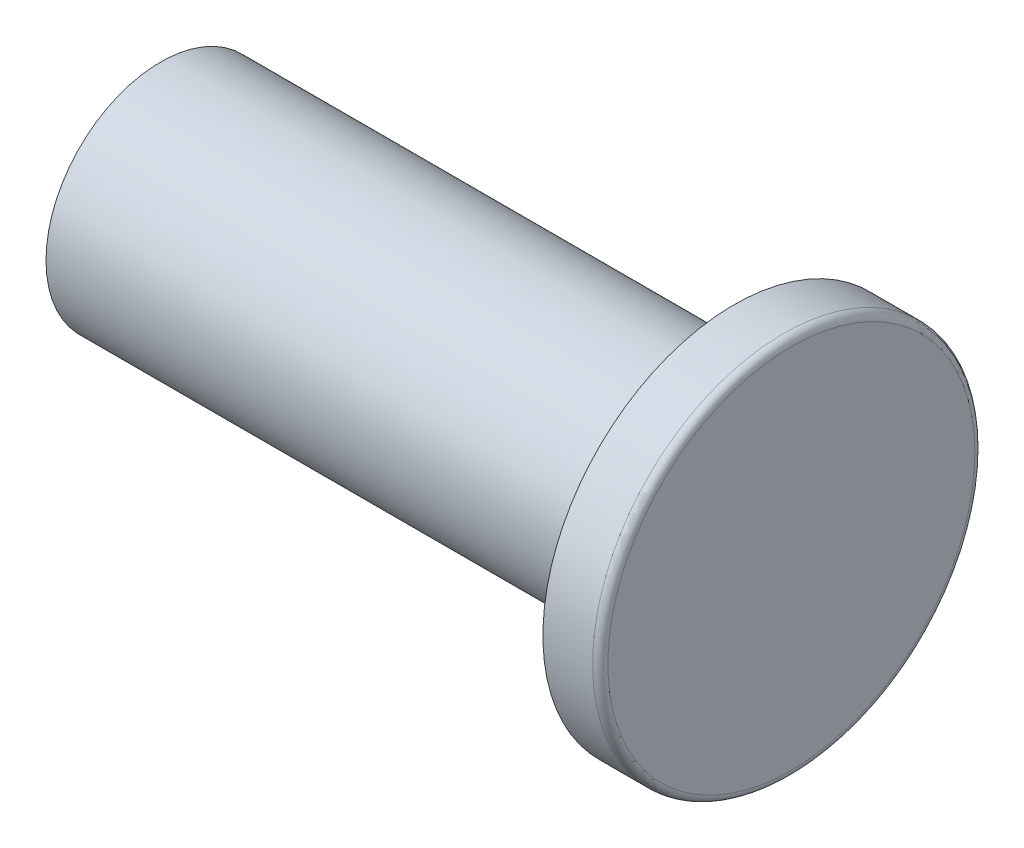
from build123d import *

# Parameters (mm, degrees)
SKETCH1_R           = 150
BOSS_EXTRUDE1_DEPTH = 750
SKETCH2_R           = 250
BOSS_EXTRUDE2_DEPTH = 75
FILLET1_R           = 10


with BuildPart() as part:
    # Sketch1 → Boss-Extrude1 (new body)
    with BuildSketch(Plane(origin=(0, 0, 0), x_dir=(0, 0, -1), z_dir=(1, 0, 0))):
        Circle(SKETCH1_R)
    extrude(amount=BOSS_EXTRUDE1_DEPTH)

    # Sketch2 → Boss-Extrude2 (add)
    with BuildSketch(Plane(origin=(750, 0, 0), x_dir=(0, 0, -1), z_dir=(1, 0, 0))):
        Circle(SKETCH2_R)
    extrude(amount=BOSS_EXTRUDE2_DEPTH)

    # Fillet1
    fillet1_edges = [part.edges().sort_by_distance(p)[0] for p in [
        (825, 0, 250),
    ]]
    fillet(fillet1_edges, radius=FILLET1_R)


solid = part.part
